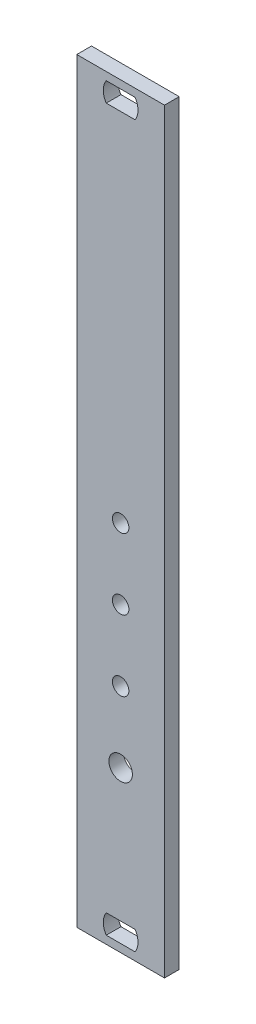
from build123d import *

# Parameters (mm, degrees)
MODEL_W                 = 14.9
MODEL_H                 = 128.4
BOSS_EXTRU_1_DEPTH      = 2.5
ESQUISSE1_R             = 1.4
ESQUISSE1_R_2           = 2
ENL_V_MAT_EXTRU_1_DEPTH = 130.285807419


with BuildPart() as part:
    # Model → Boss.-Extru.1 (new body)
    with BuildSketch(Plane.XY):
        with Locations((7.45, 64.2)):
            Rectangle(MODEL_W, MODEL_H)
        with BuildLine():
            Line((9.895403852, 123.75), (5.004596148, 123.75))
            ThreePointArc((5.004596148, 123.75), (4.5, 125.4), (5.004596148, 127.05))
            Line((5.004596148, 127.05), (9.895403852, 127.05))
            ThreePointArc((9.895403852, 127.05), (10.4, 125.4), (9.895403852, 123.75))
        make_face(mode=Mode.SUBTRACT)
        with BuildLine():
            Line((9.895403852, 1.35), (5.004596148, 1.35))
            ThreePointArc((5.004596148, 1.35), (4.5, 3), (5.004596148, 4.65))
            Line((5.004596148, 4.65), (9.895403852, 4.65))
            ThreePointArc((9.895403852, 4.65), (10.4, 3), (9.895403852, 1.35))
        make_face(mode=Mode.SUBTRACT)
    extrude(amount=BOSS_EXTRU_1_DEPTH)

    # Esquisse1 → Enlèv. mat.-Extru.1 (cut, through all)
    with BuildSketch(Plane.XY.offset(2.5)):
        with Locations((7.45, 63.2)):
            Circle(ESQUISSE1_R)
        with Locations((7.45, 51.2)):
            Circle(ESQUISSE1_R)
        with Locations((7.45, 39.2)):
            Circle(ESQUISSE1_R)
        with Locations((7.45, 27.2)):
            Circle(ESQUISSE1_R_2)
    extrude(amount=-ENL_V_MAT_EXTRU_1_DEPTH, mode=Mode.SUBTRACT)


solid = part.part
